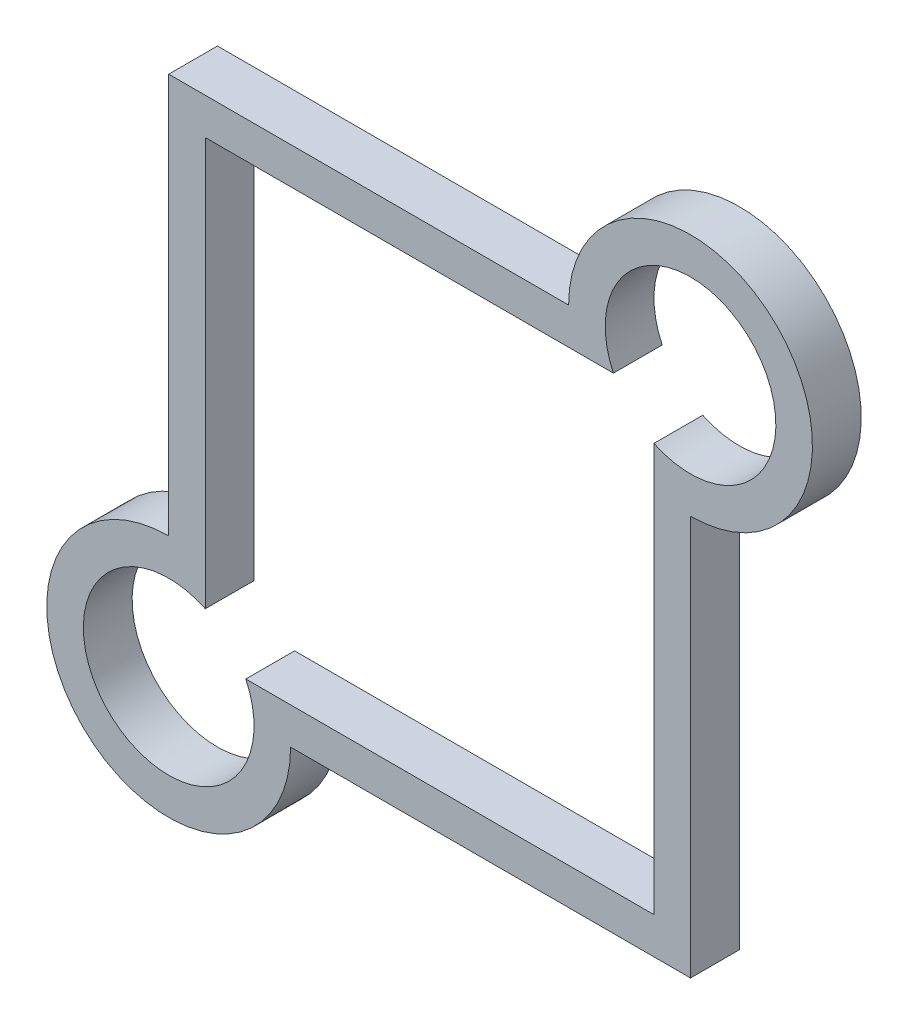
from build123d import *

# Parameters (mm, degrees)
BOSS_EXTRUDE1_DEPTH = 20


with BuildPart() as part:
    # Sketch4 → Boss-Extrude1 (new body)
    with BuildSketch(Plane.XY):
        with BuildLine():
            Line((0, 214), (164, 214))
            ThreePointArc((164, 214), (249.355339059, 249.355339059), (214, 164))
            Line((214, 164), (214, 0))
            Line((214, 0), (50, 0))
            ThreePointArc((50, 0), (-35.355339059, -35.355339059), (0, 50))
            Line((0, 50), (0, 214))
        make_face()
        with BuildLine():
            Line((31.622776602, 15), (199, 15))
            Line((199, 15), (199, 182.377223398))
            ThreePointArc((199, 182.377223398), (238.748737342, 238.748737342), (182.377223398, 199))
            Line((182.377223398, 199), (15, 199))
            Line((15, 199), (15, 31.622776602))
            ThreePointArc((15, 31.622776602), (-24.748737342, -24.748737342), (31.622776602, 15))
        make_face(mode=Mode.SUBTRACT)
    extrude(amount=BOSS_EXTRUDE1_DEPTH)


solid = part.part
